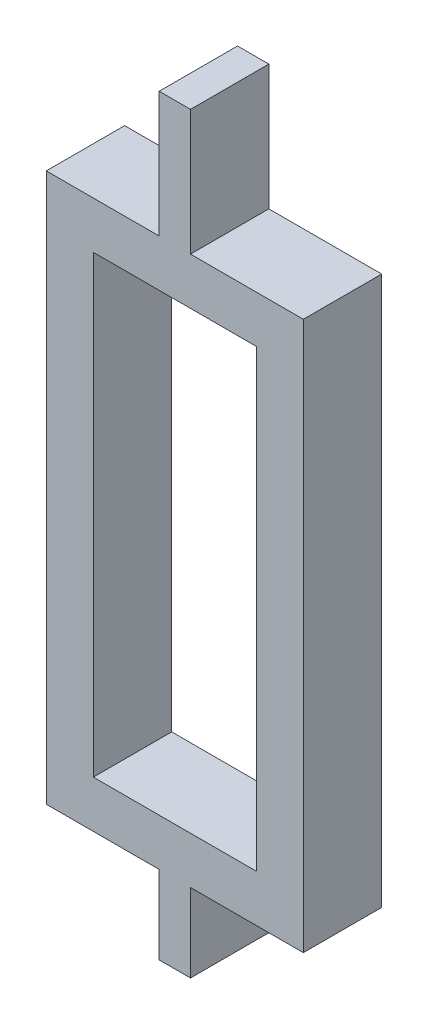
from build123d import *

# Parameters (mm, degrees)
BOSS_EXTRUDE1_DEPTH = 6.35
SKETCH3_W           = 13.208
SKETCH3_H           = 36.83
CUT_EXTRUDE1_DEPTH  = 6.35


with BuildPart() as part:
    # Sketch1 → Boss-Extrude1 (new body)
    with BuildSketch(Plane.XY):
        Polygon((10.414, 0.022003094), (10.414, 44.472003094), (1.27, 44.472003094), (1.27, 54.632003094), (-1.27, 54.632003094), (-1.27, 44.472003094), (-10.414, 44.472003094), (-10.414, 0.022003094), (-1.27, 0.022003094), (-1.27, -6.327996906), (1.27, -6.327996906), (1.27, 0.022003094), align=None)
    extrude(amount=BOSS_EXTRUDE1_DEPTH)

    # Sketch3 → Cut-Extrude1 (cut)
    with BuildSketch(Plane.XY.offset(6.35)):
        with Locations((0, 22.247003094)):
            Rectangle(SKETCH3_W, SKETCH3_H)
    extrude(amount=-CUT_EXTRUDE1_DEPTH, mode=Mode.SUBTRACT)


solid = part.part
